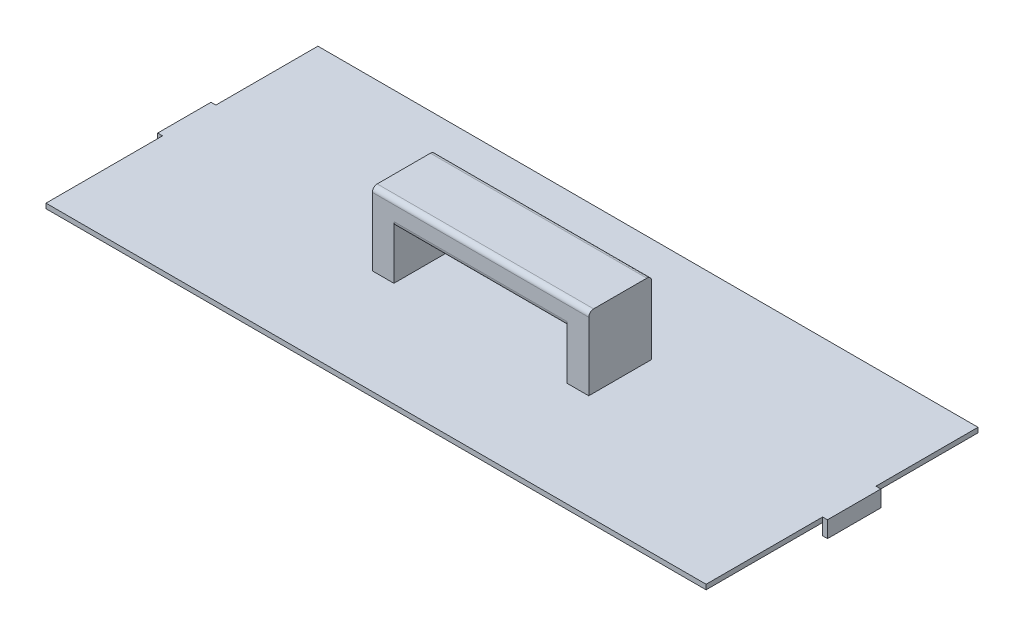
from build123d import *

# Parameters (mm, degrees)
BOSS_EXTRUDE1_DEPTH = 1
SKETCH3_W           = 4.432871169
SKETCH3_H           = 12.941954118
SKETCH3_W_2         = 4.432871168
BOSS_EXTRUDE4_DEPTH = 10
SKETCH4_W           = 44.535219178
SKETCH4_H           = 12.941954118
BOSS_EXTRUDE6_DEPTH = 5
FILLET3_R           = 1
FILLET4_R           = 1
SKETCH7_W           = 10.96861972
SKETCH7_H           = 3.370404632
BOSS_EXTRUDE7_DEPTH = 1
SKETCH9_W           = 10.96861972
SKETCH9_H           = 3.370404632
BOSS_EXTRUDE8_DEPTH = 1


with BuildPart() as part:
    # Sketch1 → Boss-Extrude1 (new body)
    with BuildSketch(Plane(origin=(0, 0, 0), x_dir=(1, 0, 0), z_dir=(0, 1, 0))):
        Polygon((76.937608383, -62.782038713), (76.937608383, -8.810873689), (-58.911197585, -8.810873689), (-58.911197585, -62.792119939), (-58.911197585, -64.768415651), (-56.350218844, -64.768415651), (74.598736982, -64.768415651), (76.937608383, -64.768415651), align=None)
    extrude(amount=BOSS_EXTRUDE1_DEPTH)

    # Sketch3 → Boss-Extrude4 (add)
    with BuildSketch(Plane(origin=(0, 1, 0), x_dir=(1, 0, 0), z_dir=(0, 1, 0))):
        with Locations((-11.037968606, -36.78964467)):
            Rectangle(SKETCH3_W, SKETCH3_H)
        with Locations((29.064379404, -36.78964467)):
            Rectangle(SKETCH3_W_2, SKETCH3_H)
    extrude(amount=BOSS_EXTRUDE4_DEPTH)

    # Sketch4 → Boss-Extrude6 (add)
    with BuildSketch(Plane(origin=(0, 11, 0), x_dir=(1, 0, 0), z_dir=(0, 1, 0))):
        with Locations((9.013205399, -36.78964467)):
            Rectangle(SKETCH4_W, SKETCH4_H)
    extrude(amount=BOSS_EXTRUDE6_DEPTH)

    # Fillet3
    fillet3_edges = [part.edges().sort_by_distance(p)[0] for p in [
        (9.013205399, 16, 30.318667611),
        (9.013205399, 16, 43.260621729),
    ]]
    fillet(fillet3_edges, radius=FILLET3_R)

    # Fillet4
    fillet4_edges = [part.edges().sort_by_distance(p)[0] for p in [
        (9.013205399, 11, 43.260621729),
        (9.013205399, 11, 30.318667611),
    ]]
    fillet(fillet4_edges, radius=FILLET4_R)

    # Sketch7 → Boss-Extrude7 (add)
    with BuildSketch(Plane.ZY.offset(58.911197585)):
        with Locations((35.300658133, -0.685202316)):
            Rectangle(SKETCH7_W, SKETCH7_H)
    extrude(amount=BOSS_EXTRUDE7_DEPTH)

    # Sketch9 → Boss-Extrude8 (add)
    with BuildSketch(Plane(origin=(76.937608383, 0, 0), x_dir=(0, 0, -1), z_dir=(1, 0, 0))):
        with Locations((-35.300658133, -0.685202316)):
            Rectangle(SKETCH9_W, SKETCH9_H)
    extrude(amount=BOSS_EXTRUDE8_DEPTH)


solid = part.part
